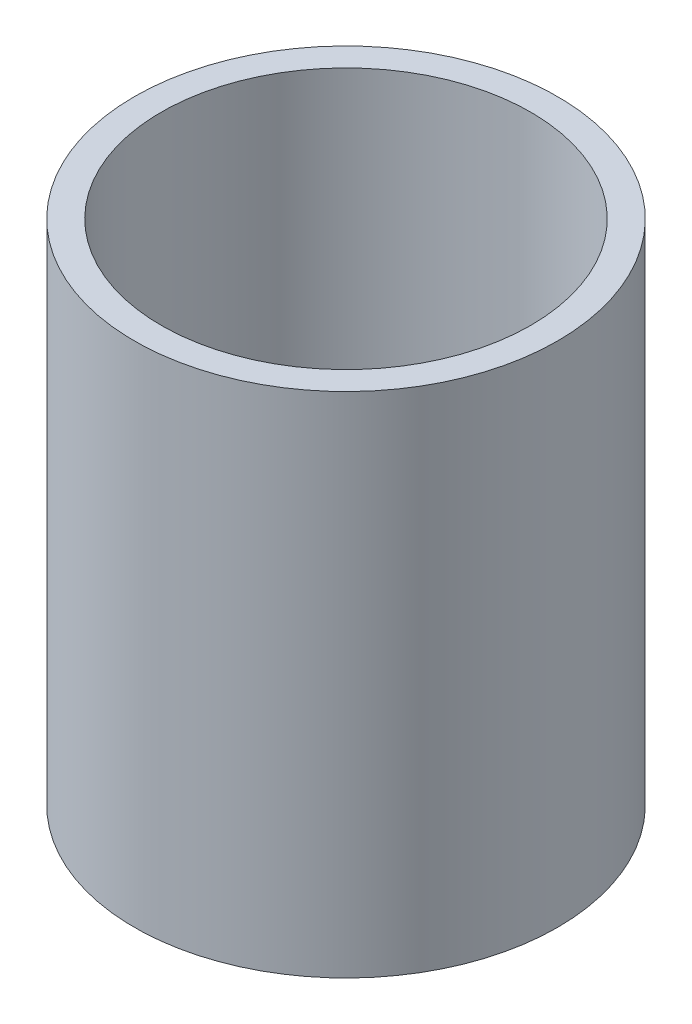
from build123d import *


with BuildPart() as part:
    # Sketch2 → Revolve1 (revolve)
    with BuildSketch(Plane.XY):
        Polygon((12.5, 30), (10.9125, 30), (10.9125, 1.5875), (0, 1.5875), (0, 0), (12.5, 0), align=None)
    revolve(axis=Axis((0, 0, 0), (0, 1, 0)))


solid = part.part
